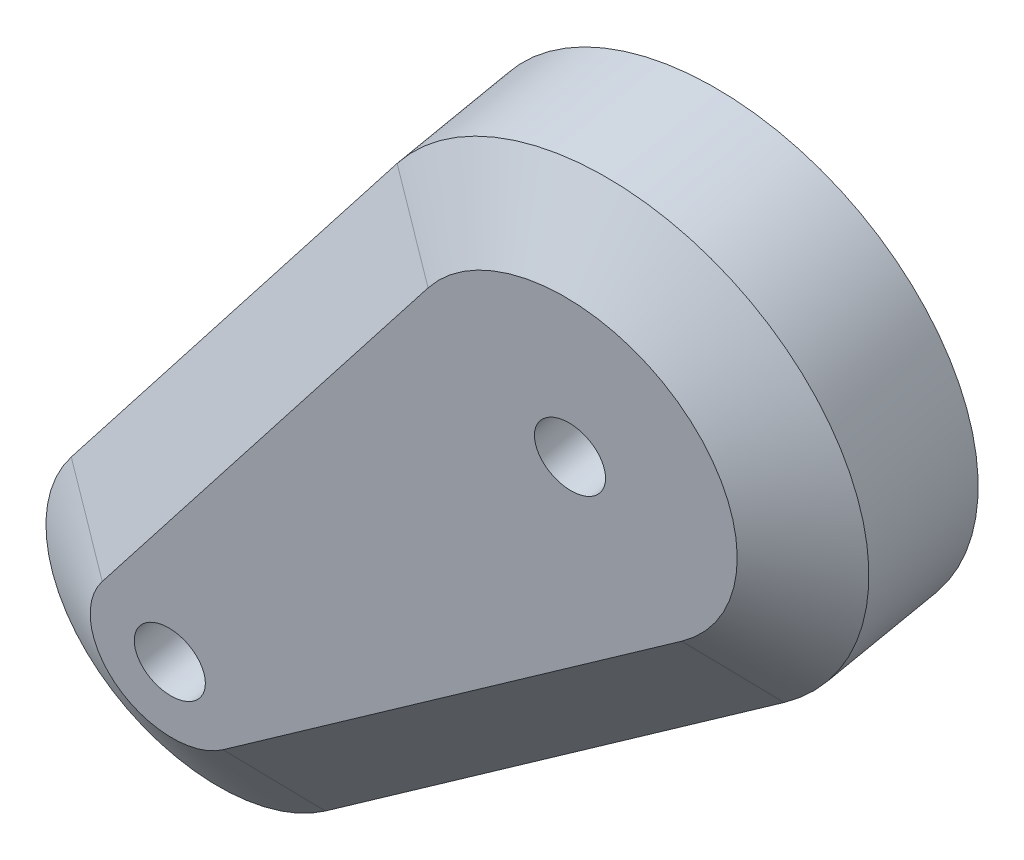
from build123d import *
from OCP.BRepFilletAPI import BRepFilletAPI_MakeChamfer

# Parameters (mm, degrees)
BOSS_EXTRUDE1_DEPTH = 2.5
BOSS_EXTRUDE2_START = -7
BOSS_EXTRUDE2_DEPTH = 7
SKETCH5_R           = 1.4
CUT_EXTRUDE1_DEPTH  = 224.867234146
CHAMFER1_SIZE       = 2
CHAMFER1_SIZE2      = 3.464101615


with BuildPart() as part:
    # Sketch3 → Boss-Extrude1 (new body)
    with BuildSketch(Plane(origin=(1.259195374, -2.30572666, 18.480527867), x_dir=(0.9977133208531901, 0.0041871636292656654, -0.06745811332109086), z_dir=(0.06745811332109086, -0.12352330189874, 0.9900461589416888))):
        with BuildLine():
            Line((135.30958495, -139.424629776), (150.353464879, -120.397565455))
            ThreePointArc((150.353464879, -120.397565455), (161.745869588, -119.876144071), (160.65785881, -131.228456517))
            Line((160.65785881, -131.228456517), (140.905348542, -145.306305717))
            ThreePointArc((140.905348542, -145.306305717), (135.555316481, -144.793556216), (135.30958495, -139.424629776))
        make_face()
    extrude(amount=BOSS_EXTRUDE1_DEPTH)

    # Sketch4 → Boss-Extrude2 (add)
    with BuildSketch(Plane(origin=(1.427840657, -2.614534914, 20.955643264), x_dir=(0.9977133208531901, 0.0041871636292656654, -0.06745811332109086), z_dir=(0.06745811332109086, -0.12352330189874, 0.9900461589416888)).offset(BOSS_EXTRUDE2_START)):
        with BuildLine():
            Line((142.356321643, -147.342153712), (162.108831911, -133.264304512))
            ThreePointArc((162.108831911, -133.264304512), (163.557111158, -118.152948211), (148.39238701, -118.847025681))
            Line((148.39238701, -118.847025681), (133.348507081, -137.874090002))
            ThreePointArc((133.348507081, -137.874090002), (133.744074911, -146.516752076), (142.356321643, -147.342153712))
        make_face()
        with BuildLine():
            Line((140.905348542, -145.306305717), (160.65785881, -131.228456517))
            ThreePointArc((160.65785881, -131.228456517), (161.745869588, -119.876144071), (150.353464879, -120.397565455))
            Line((150.353464879, -120.397565455), (135.30958495, -139.424629776))
            ThreePointArc((135.30958495, -139.424629776), (135.555316481, -144.793556216), (140.905348542, -145.306305717))
        make_face(mode=Mode.SUBTRACT)
    extrude(amount=BOSS_EXTRUDE2_DEPTH)

    # Sketch5 → Cut-Extrude1 (cut, through all)
    with BuildSketch(Plane(origin=(1.259195374, -2.30572666, 18.480527867), x_dir=(-0.9977221070754917, -0.008351673114375563, 0.06693912614481723), z_dir=(-0.06745811332109086, 0.12352330189874014, -0.9900461589416888))):
        with Locations(Location((-155.749616863, -125.734940876, 0), (0, 0, 90))):
            Circle(SKETCH5_R)
        with Locations(Location((-137.928734379, -142.547619054, 0), (0, 0, 90))):
            Circle(SKETCH5_R)
    extrude(amount=-CUT_EXTRUDE1_DEPTH, mode=Mode.SUBTRACT)

    # Chamfer1: one chamfer whose edges measure the first distance from different faces: ONE call of the kernel's chamfer builder (chamfer() names one face for all edges)
    chamfer1_edges_1 = [part.edges().sort_by_distance(p)[0] for p in [
        (134.252596166, -147.447911004, -6.164712697),
    ]]
    chamfer1_side_1 = [part.faces().sort_by_distance(p)[0] for p in [
        (134.016492769, -147.015579447, -9.629874253),
    ]]
    chamfer1_edges_2 = [part.edges().sort_by_distance(p)[0] for p in [
        (152.724837797, -141.204613744, -6.644397278),
    ]]
    chamfer1_side_2 = [part.faces().sort_by_distance(p)[0] for p in [
        (152.488734401, -140.772282187, -10.109558834),
    ]]
    chamfer1_edges_3 = [part.edges().sort_by_distance(p)[0] for p in [
        (164.116223453, -119.176744954, -4.672253167),
    ]]
    chamfer1_side_3 = [part.faces().sort_by_distance(p)[0] for p in [
        (163.880120056, -118.744413397, -8.137414723),
    ]]
    chamfer1_edges_4 = [part.edges().sort_by_distance(p)[0] for p in [
        (141.438695529, -129.401083964, -4.402731254),
    ]]
    chamfer1_side_4 = [part.faces().sort_by_distance(p)[0] for p in [
        (141.202592133, -128.968752407, -7.867892811),
    ]]
    chamfer1 = BRepFilletAPI_MakeChamfer(part.part.solid().wrapped)
    for e in chamfer1_edges_1:
        chamfer1.Add(CHAMFER1_SIZE, CHAMFER1_SIZE2, e.wrapped, chamfer1_side_1[0].wrapped)  # the first distance lies on this face
    for e in chamfer1_edges_2:
        chamfer1.Add(CHAMFER1_SIZE, CHAMFER1_SIZE2, e.wrapped, chamfer1_side_2[0].wrapped)  # the first distance lies on this face
    for e in chamfer1_edges_3:
        chamfer1.Add(CHAMFER1_SIZE, CHAMFER1_SIZE2, e.wrapped, chamfer1_side_3[0].wrapped)  # the first distance lies on this face
    for e in chamfer1_edges_4:
        chamfer1.Add(CHAMFER1_SIZE, CHAMFER1_SIZE2, e.wrapped, chamfer1_side_4[0].wrapped)  # the first distance lies on this face
    add(Compound.cast(chamfer1.Shape()), mode=Mode.REPLACE)


solid = part.part
